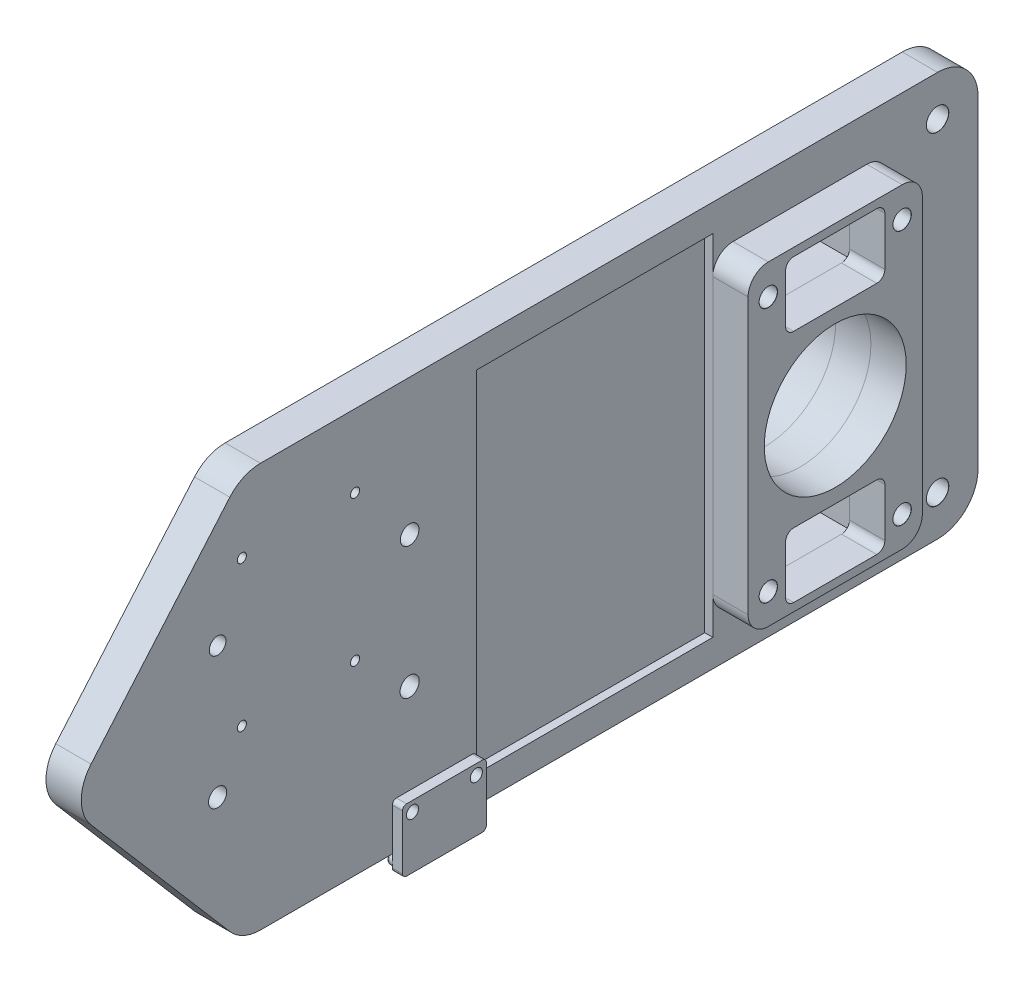
from build123d import *

# Parameters (mm, degrees)
SKETCH1_R                            = 17.5641
BOSS_EXTRUDE1_DEPTH                  = 4.365625
SKETCH2_W                            = 78.1
SKETCH2_H                            = 43.1
BOSS_EXTRUDE2_DEPTH                  = 8.73125
M4_CLEARANCE_HOLE2_AT_2_COUNT        = 2
M4_CLEARANCE_HOLE2_AT_2_PITCH        = 33.1
M4_CLEARANCE_HOLE2_AT_3_COUNT        = 2
M4_CLEARANCE_HOLE2_AT_3_PITCH        = 71.254613886
M4_CLEARANCE_HOLE2_AT_4_COUNT        = 2
M4_CLEARANCE_HOLE2_AT_4_PITCH        = 63.1
SKETCH24_W                           = 78.1
SKETCH24_H                           = 43.1
BOSS_EXTRUDE3_DEPTH                  = 8.73125
TAP_DRILL_FOR_M4X0_7_TAP1_AT_2_COUNT = 2
TAP_DRILL_FOR_M4X0_7_TAP1_AT_2_PITCH = 33.1
TAP_DRILL_FOR_M4X0_7_TAP1_AT_3_COUNT = 2
TAP_DRILL_FOR_M4X0_7_TAP1_AT_3_PITCH = 71.254613886
TAP_DRILL_FOR_M4X0_7_TAP1_AT_4_COUNT = 2
TAP_DRILL_FOR_M4X0_7_TAP1_AT_4_PITCH = 63.1
TAP_DRILL_FOR_M3X0_5_TAP1_AT_2_COUNT = 2
TAP_DRILL_FOR_M3X0_5_TAP1_AT_2_PITCH = 15.8
SKETCH3_R                            = 17.5641
CUT_EXTRUDE3_DEPTH                   = 190.54950551
M5_CLEARANCE_HOLE1_AT_2_COUNT        = 2
M5_CLEARANCE_HOLE1_AT_2_PITCH        = 80
SKETCH14_W                           = 86.5
SKETCH14_H                           = 58.5
CUT_EXTRUDE4_DEPTH                   = 2
FILLET4_R                            = 10
FILLET5_R                            = 5
FILLET6_R                            = 5
SKETCH28_W                           = 15.5
SKETCH28_H                           = 20.75
SKETCH28_R                           = 1.5
BOSS_EXTRUDE4_DEPTH                  = 2.5
FILLET7_R                            = 1
SKETCH29_R                           = 1.5
BOSS_EXTRUDE5_DEPTH                  = 1.5
FILLET8_R                            = 0.5
SKETCH34_W                           = 1.1303
SKETCH34_H                           = 17.4625
TAP_DRILL_FOR_4_40_TAP1_AT_2_COUNT   = 2
TAP_DRILL_FOR_4_40_TAP1_AT_2_PITCH   = 28
TAP_DRILL_FOR_4_40_TAP1_AT_3_COUNT   = 2
TAP_DRILL_FOR_4_40_TAP1_AT_3_PITCH   = 45.607017004
TAP_DRILL_FOR_4_40_TAP1_AT_4_COUNT   = 2
TAP_DRILL_FOR_4_40_TAP1_AT_4_PITCH   = 36
SKETCH35_R                           = 2.25
SKETCH35_R_2                         = 2.064953437
SKETCH35_R_3                         = 2.37369371
SKETCH35_R_4                         = 2.309555233
CUT_EXTRUDE5_DEPTH                   = 187.620222532
SKETCH36_W                           = 16
SKETCH36_H                           = 24.55
CUT_EXTRUDE6_DEPTH                   = 188.638698276
FILLET9_R                            = 2
FILLET10_R                           = 2


with BuildPart() as part:
    # Sketch1 → Boss-Extrude1 (new, symmetric)
    with BuildSketch(Plane.YZ):
        Polygon((-50, 138.05), (-50, -44.05), (50, -44.05), (50, 138.05), (0, 180.95), align=None)
        with Locations(Location((0, 0, 0), (0, 0, 270))):
            Circle(SKETCH1_R, mode=Mode.SUBTRACT)
    extrude(amount=BOSS_EXTRUDE1_DEPTH, both=True)


with BuildPart() as body_2:
    # Sketch2 → Boss-Extrude2 (new body)
    with BuildSketch(Plane.YZ.offset(4.365625)):
        Rectangle(SKETCH2_W, SKETCH2_H)
    extrude(amount=BOSS_EXTRUDE2_DEPTH)


with BuildPart() as m4_clearance_hole2_tool:
    # Sketch23 → M4 Clearance Hole2 (revolve)
    with BuildSketch(Plane(origin=(13.096875, -31.55, 16.55), x_dir=(0, 0, -1), z_dir=(0, 1, 0))):
        Polygon((0, 0), (0, 17.4625), (2.25, 17.4625), (2.25, 0.025), (2.275, 0), align=None)
    m4_clearance_hole2 = revolve(axis=Axis((19.446875, -31.55, 16.55), (-1, 0, 0)))


with BuildPart() as part_1:
    add(part.part)

    # M4 Clearance Hole2: cut by m4_clearance_hole2_tool
    add(m4_clearance_hole2_tool.part, mode=Mode.SUBTRACT)


with BuildPart() as body_2_1:
    add(body_2.part)

    # M4 Clearance Hole2: cut by m4_clearance_hole2_tool
    add(m4_clearance_hole2_tool.part, mode=Mode.SUBTRACT)


with BuildPart() as m4_clearance_hole2_at_2_tool:
    # M4 Clearance Hole2 at 2: M4 Clearance Hole2 ×2
    with Locations(*[(0, 0, -i * M4_CLEARANCE_HOLE2_AT_2_PITCH) for i in range(1, M4_CLEARANCE_HOLE2_AT_2_COUNT)]):
        add(m4_clearance_hole2)


with BuildPart() as part_2:
    add(part_1.part)

    # M4 Clearance Hole2 at 2: cut by m4_clearance_hole2_at_2_tool
    add(m4_clearance_hole2_at_2_tool.part, mode=Mode.SUBTRACT)


with BuildPart() as body_2_2:
    add(body_2_1.part)

    # M4 Clearance Hole2 at 2: cut by m4_clearance_hole2_at_2_tool
    add(m4_clearance_hole2_at_2_tool.part, mode=Mode.SUBTRACT)


with BuildPart() as m4_clearance_hole2_at_3_tool:
    # M4 Clearance Hole2 at 3: M4 Clearance Hole2 ×2
    with Locations(*[Vector(0, 0.8855566897214588, -0.4645313221835228) * (i * M4_CLEARANCE_HOLE2_AT_3_PITCH) for i in range(1, M4_CLEARANCE_HOLE2_AT_3_COUNT)]):
        add(m4_clearance_hole2)


with BuildPart() as part_3:
    add(part_2.part)

    # M4 Clearance Hole2 at 3: cut by m4_clearance_hole2_at_3_tool
    add(m4_clearance_hole2_at_3_tool.part, mode=Mode.SUBTRACT)


with BuildPart() as body_2_3:
    add(body_2_2.part)

    # M4 Clearance Hole2 at 3: cut by m4_clearance_hole2_at_3_tool
    add(m4_clearance_hole2_at_3_tool.part, mode=Mode.SUBTRACT)


with BuildPart() as m4_clearance_hole2_at_4_tool:
    # M4 Clearance Hole2 at 4: M4 Clearance Hole2 ×2
    with Locations(*[(0, i * M4_CLEARANCE_HOLE2_AT_4_PITCH, 0) for i in range(1, M4_CLEARANCE_HOLE2_AT_4_COUNT)]):
        add(m4_clearance_hole2)


with BuildPart() as part_4:
    add(part_3.part)

    # M4 Clearance Hole2 at 4: cut by m4_clearance_hole2_at_4_tool
    add(m4_clearance_hole2_at_4_tool.part, mode=Mode.SUBTRACT)

    # Sketch10 → Tap Drill for M3x0.5 Tap1 (revolve, cut)
    with BuildSketch(Plane(origin=(4.365625, -41, 98.35), x_dir=(0, 0, -1), z_dir=(0, 1, 0))):
        Polygon((0, 0), (0, 17.4625), (1.25, 17.4625), (1.25, 0.025), (1.275, 0), align=None)
    tap_drill_for_m3x0_5_tap1 = revolve(axis=Axis((10.715625, -41, 98.35), (-1, 0, 0)), mode=Mode.SUBTRACT)

    # Tap Drill for M3x0.5 Tap1 at 2: Tap Drill for M3x0.5 Tap1 ×2
    with Locations(*[(0, 0, -i * TAP_DRILL_FOR_M3X0_5_TAP1_AT_2_PITCH) for i in range(1, TAP_DRILL_FOR_M3X0_5_TAP1_AT_2_COUNT)]):
        add(tap_drill_for_m3x0_5_tap1, mode=Mode.SUBTRACT)

    # Sketch12 → M5 Clearance Hole1 (revolve, cut)
    with BuildSketch(Plane(origin=(4.365625, -40, -34.05), x_dir=(0, 0, -1), z_dir=(0, 1, 0))):
        Polygon((0, 0), (0, 17.4625), (2.75, 17.4625), (2.75, 0.025), (2.775, 0), align=None)
    m5_clearance_hole1 = revolve(axis=Axis((10.715625, -40, -34.05), (-1, 0, 0)), mode=Mode.SUBTRACT)

    # M5 Clearance Hole1 at 2: M5 Clearance Hole1 ×2
    with Locations(*[(0, i * M5_CLEARANCE_HOLE1_AT_2_PITCH, 0) for i in range(1, M5_CLEARANCE_HOLE1_AT_2_COUNT)]):
        add(m5_clearance_hole1, mode=Mode.SUBTRACT)

    # Sketch14 → Cut-Extrude4 (cut)
    with BuildSketch(Plane.YZ.offset(4.365625)):
        with Locations((0, 50.8)):
            Rectangle(SKETCH14_W, SKETCH14_H)
    extrude(amount=-CUT_EXTRUDE4_DEPTH, mode=Mode.SUBTRACT)

    # Fillet4
    fillet4_edges = [part_4.edges().sort_by_distance(p)[0] for p in [
        (0, -50, 138.05),
        (0, 0, 180.95),
        (0, 50, 138.05),
        (0, 50, -44.05),
        (0, -50, -44.05),
    ]]
    fillet(fillet4_edges, radius=FILLET4_R)

    # Sketch34 → Tap Drill for #4-40 Tap1 (revolve, cut)
    with BuildSketch(Plane(origin=(4.365625, -4, 138.05), x_dir=(0, 0, -1), z_dir=(0, 1, 0))):
        with Locations((0.56515, 8.73125)):
            Rectangle(SKETCH34_W, SKETCH34_H)
    tap_drill_for_4_40_tap1 = revolve(axis=Axis((10.715625, -4, 138.05), (-1, 0, 0)), mode=Mode.SUBTRACT)

    # Tap Drill for #4-40 Tap1 at 2: Tap Drill for #4-40 Tap1 ×2
    with Locations(*[(0, 0, -i * TAP_DRILL_FOR_4_40_TAP1_AT_2_PITCH) for i in range(1, TAP_DRILL_FOR_4_40_TAP1_AT_2_COUNT)]):
        add(tap_drill_for_4_40_tap1, mode=Mode.SUBTRACT)

    # Tap Drill for #4-40 Tap1 at 3: Tap Drill for #4-40 Tap1 ×2
    with Locations(*[Vector(0, 0.789352217376326, -0.6139406135149208) * (i * TAP_DRILL_FOR_4_40_TAP1_AT_3_PITCH) for i in range(1, TAP_DRILL_FOR_4_40_TAP1_AT_3_COUNT)]):
        add(tap_drill_for_4_40_tap1, mode=Mode.SUBTRACT)

    # Tap Drill for #4-40 Tap1 at 4: Tap Drill for #4-40 Tap1 ×2
    with Locations(*[(0, i * TAP_DRILL_FOR_4_40_TAP1_AT_4_PITCH, 0) for i in range(1, TAP_DRILL_FOR_4_40_TAP1_AT_4_COUNT)]):
        add(tap_drill_for_4_40_tap1, mode=Mode.SUBTRACT)

    # Sketch35 → Cut-Extrude5 (cut, through all)
    with BuildSketch(Plane.YZ.offset(4.365625)):
        with Locations(Location((-16.25, 144.05, 0), (0, 0, 270))):
            Circle(SKETCH35_R)
        with Locations(Location((16.25, 144.05, 0), (0, 0, 270))):
            Circle(SKETCH35_R_2)
        with Locations(Location((-16.25, 96.55, 0), (0, 0, 270))):
            Circle(SKETCH35_R_3)
        with Locations(Location((16.25, 96.55, 0), (0, 0, 270))):
            Circle(SKETCH35_R_4)
    extrude(amount=-CUT_EXTRUDE5_DEPTH, mode=Mode.SUBTRACT)


with BuildPart() as body_2_4:
    add(body_2_3.part)

    # M4 Clearance Hole2 at 4: cut by m4_clearance_hole2_at_4_tool
    add(m4_clearance_hole2_at_4_tool.part, mode=Mode.SUBTRACT)


with BuildPart() as body_3:
    # Sketch24 → Boss-Extrude3 (new body)
    with BuildSketch(Plane(origin=(-4.365625, 0, 0), x_dir=(0, -1, 0), z_dir=(-1, 0, 0))):
        Rectangle(SKETCH24_W, SKETCH24_H)
    extrude(amount=BOSS_EXTRUDE3_DEPTH)

    # Sketch27 → Tap Drill for M4x0.7 Tap1 (revolve, cut)
    with BuildSketch(Plane(origin=(-13.096875, 31.55, 16.55), x_dir=(0, 0, 1), z_dir=(0, 1, 0))):
        Polygon((0, 0), (0, 9.722670021), (1.65, 8.73125), (1.65, 0.025), (1.675, 0), align=None)
    tap_drill_for_m4x0_7_tap1 = revolve(axis=Axis((-19.446875, 31.55, 16.55), (1, 0, 0)), mode=Mode.SUBTRACT)

    # Tap Drill for M4x0.7 Tap1 at 2: Tap Drill for M4x0.7 Tap1 ×2
    with Locations(*[(0, 0, -i * TAP_DRILL_FOR_M4X0_7_TAP1_AT_2_PITCH) for i in range(1, TAP_DRILL_FOR_M4X0_7_TAP1_AT_2_COUNT)]):
        add(tap_drill_for_m4x0_7_tap1, mode=Mode.SUBTRACT)

    # Tap Drill for M4x0.7 Tap1 at 3: Tap Drill for M4x0.7 Tap1 ×2
    with Locations(*[Vector(0, -0.8855566897214588, -0.4645313221835228) * (i * TAP_DRILL_FOR_M4X0_7_TAP1_AT_3_PITCH) for i in range(1, TAP_DRILL_FOR_M4X0_7_TAP1_AT_3_COUNT)]):
        add(tap_drill_for_m4x0_7_tap1, mode=Mode.SUBTRACT)

    # Tap Drill for M4x0.7 Tap1 at 4: Tap Drill for M4x0.7 Tap1 ×2
    with Locations(*[(0, -i * TAP_DRILL_FOR_M4X0_7_TAP1_AT_4_PITCH, 0) for i in range(1, TAP_DRILL_FOR_M4X0_7_TAP1_AT_4_COUNT)]):
        add(tap_drill_for_m4x0_7_tap1, mode=Mode.SUBTRACT)


with BuildPart() as cut_extrude3_tool:
    # Sketch3 → Cut-Extrude3 (new, through all)
    with BuildSketch(Plane.YZ.offset(13.096875)):
        with Locations(Location((0, 0, 0), (0, 0, 270))):
            Circle(SKETCH3_R)
    extrude(amount=-CUT_EXTRUDE3_DEPTH)


with BuildPart() as body_2_5:
    add(body_2_4.part)

    # Cut-Extrude3: cut by cut_extrude3_tool
    add(cut_extrude3_tool.part, mode=Mode.SUBTRACT)

    # Fillet6
    fillet6_edges = [body_2_5.edges().sort_by_distance(p)[0] for p in [
        (8.73125, -39.05, 21.55),
        (8.73125, 39.05, 21.55),
        (8.73125, 39.05, -21.55),
        (8.73125, -39.05, -21.55),
    ]]
    fillet(fillet6_edges, radius=FILLET6_R)


with BuildPart() as body_3_1:
    add(body_3.part)

    # Cut-Extrude3: cut by cut_extrude3_tool
    add(cut_extrude3_tool.part, mode=Mode.SUBTRACT)

    # Fillet5
    fillet5_edges = [body_3_1.edges().sort_by_distance(p)[0] for p in [
        (-8.73125, -39.05, 21.55),
        (-8.73125, -39.05, -21.55),
        (-8.73125, 39.05, -21.55),
        (-8.73125, 39.05, 21.55),
    ]]
    fillet(fillet5_edges, radius=FILLET5_R)


with BuildPart() as body_4:
    # Sketch28 → Boss-Extrude4 (new body)
    with BuildSketch(Plane.YZ.offset(4.365625)):
        with Locations((-46.275, 90.45)):
            Rectangle(SKETCH28_W, SKETCH28_H)
        with Locations(Location((-41, 82.55, 0), (0, 0, 270))):
            Circle(SKETCH28_R, mode=Mode.SUBTRACT)
        with Locations(Location((-41, 98.35, 0), (0, 0, 270))):
            Circle(SKETCH28_R, mode=Mode.SUBTRACT)
    extrude(amount=BOSS_EXTRUDE4_DEPTH)

    # Fillet7
    fillet7_edges = [body_4.edges().sort_by_distance(p)[0] for p in [
        (5.615625, -38.525, 80.075),
        (5.615625, -54.025, 80.075),
        (5.615625, -54.025, 100.825),
        (5.615625, -38.525, 100.825),
    ]]
    fillet(fillet7_edges, radius=FILLET7_R)

    # Sketch29 → Boss-Extrude5 (add)
    with BuildSketch(Plane(origin=(4.365625, 0, 0), x_dir=(0, -1, 0), z_dir=(-1, 0, 0))):
        with Locations(Location((52.025, 99.2, 0), (0, 0, 90))):
            Circle(SKETCH29_R)
        with Locations(Location((52.025, 95.7, 0), (0, 0, 90))):
            Circle(SKETCH29_R)
        with Locations(Location((52.025, 92.2, 0), (0, 0, 90))):
            Circle(SKETCH29_R)
        with Locations(Location((52.025, 88.7, 0), (0, 0, 90))):
            Circle(SKETCH29_R)
        with Locations(Location((52.025, 85.2, 0), (0, 0, 90))):
            Circle(SKETCH29_R)
        with Locations(Location((52.025, 81.7, 0), (0, 0, 90))):
            Circle(SKETCH29_R)
    extrude(amount=BOSS_EXTRUDE5_DEPTH)

    # Fillet8
    fillet8_edges = [body_4.edges().sort_by_distance(p)[0] for p in [
        (2.865625, -52.025, 97.7),
        (2.865625, -52.025, 94.2),
        (2.865625, -52.025, 90.7),
        (2.865625, -52.025, 87.2),
        (2.865625, -52.025, 83.7),
        (2.865625, -52.025, 80.2),
    ]]
    fillet(fillet8_edges, radius=FILLET8_R)


with BuildPart() as cut_extrude6_tool:
    # Sketch36 → Cut-Extrude6 (new, through all)
    with BuildSketch(Plane.YZ.offset(13.096875)):
        with Locations((-29.05, 0)):
            Rectangle(SKETCH36_W, SKETCH36_H)
        with Locations((29.05, 0)):
            Rectangle(SKETCH36_W, SKETCH36_H)
    extrude(amount=-CUT_EXTRUDE6_DEPTH)


with BuildPart() as part_5:
    add(part_4.part)

    # Cut-Extrude6: cut by cut_extrude6_tool
    add(cut_extrude6_tool.part, mode=Mode.SUBTRACT)


with BuildPart() as body_2_6:
    add(body_2_5.part)

    # Cut-Extrude6: cut by cut_extrude6_tool
    add(cut_extrude6_tool.part, mode=Mode.SUBTRACT)

    # Fillet9
    fillet9_edges = [body_2_6.edges().sort_by_distance(p)[0] for p in [
        (8.73125, -37.05, -12.275),
        (8.73125, -37.05, 12.275),
        (8.73125, -21.05, 12.275),
        (8.73125, -21.05, -12.275),
        (8.73125, 21.05, 12.275),
        (8.73125, 37.05, 12.275),
        (8.73125, 37.05, -12.275),
        (8.73125, 21.05, -12.275),
    ]]
    fillet(fillet9_edges, radius=FILLET9_R)


with BuildPart() as body_3_2:
    add(body_3_1.part)

    # Cut-Extrude6: cut by cut_extrude6_tool
    add(cut_extrude6_tool.part, mode=Mode.SUBTRACT)

    # Fillet10
    fillet10_edges = [body_3_2.edges().sort_by_distance(p)[0] for p in [
        (-8.73125, -37.05, -12.275),
        (-8.73125, -37.05, 12.275),
        (-8.73125, -21.05, 12.275),
        (-8.73125, -21.05, -12.275),
        (-8.73125, 21.05, 12.275),
        (-8.73125, 37.05, 12.275),
        (-8.73125, 37.05, -12.275),
        (-8.73125, 21.05, -12.275),
    ]]
    fillet(fillet10_edges, radius=FILLET10_R)


solid = Compound([body_4.part, part_5.part, body_2_6.part, body_3_2.part])
